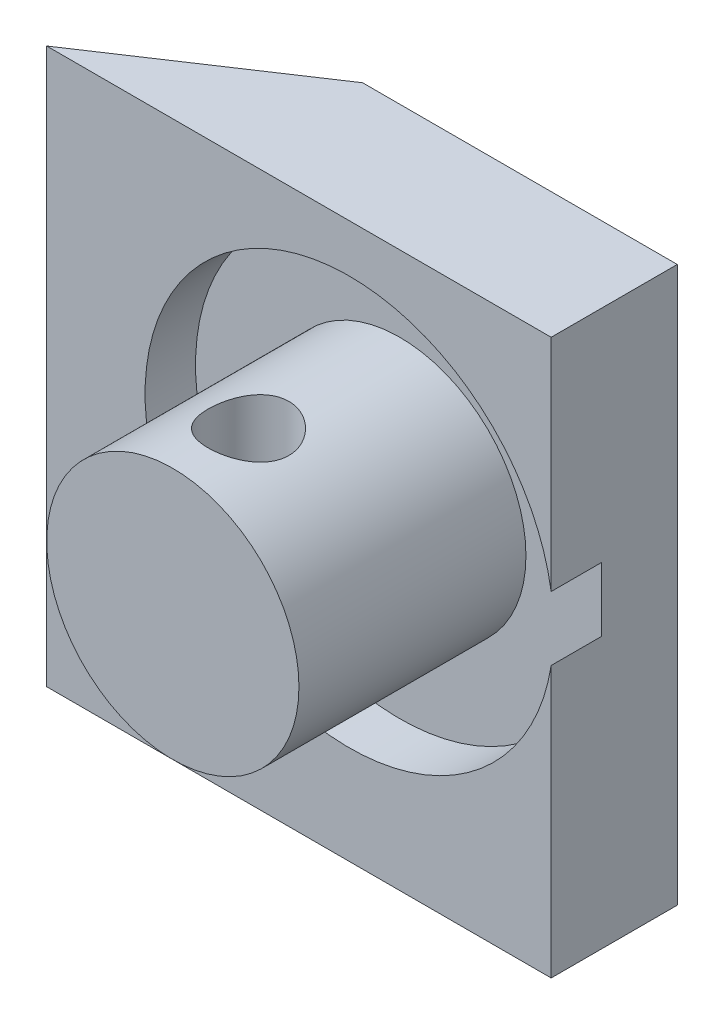
from build123d import *

# Parameters (mm, degrees)
EXTRUDE_1_DEPTH     = 22
SKETCH_2_R          = 5
EXTRUDE_2_DEPTH     = 7
CUT_EXTRUDE_START   = -2
SKETCH_3_R          = 8.1
SKETCH_3_R_2        = 5
CUT_EXTRUDE_1_DEPTH = 2
SKETCH_4_R          = 1.6
CUT_EXTRUDE_2_DEPTH = 31.545048699


with BuildPart() as part:
    # 草图1 → 凸台-拉伸1 (new body)
    with BuildSketch(Plane(origin=(0, 0, 0), x_dir=(1, 0, 0), z_dir=(0, 1, 0))):
        Polygon((0, 0), (-20, 0), (-12.477453102, 5), (0, 5), align=None)
    extrude(amount=EXTRUDE_1_DEPTH)

    # 草图2 → 凸台-拉伸2 (add)
    with BuildSketch(Plane.XY):
        with Locations((-8, 12)):
            Circle(SKETCH_2_R)
    extrude(amount=EXTRUDE_2_DEPTH)

    # 草图3 → 切除-拉伸1 (cut)
    with BuildSketch(Plane.XY.offset(CUT_EXTRUDE_START)):
        with Locations((-8, 12)):
            Circle(SKETCH_3_R)
        with Locations((-8, 12)):
            Circle(SKETCH_3_R_2, mode=Mode.SUBTRACT)
    extrude(amount=CUT_EXTRUDE_1_DEPTH, mode=Mode.SUBTRACT)

    # 草图4 → 切除-拉伸2 (cut, through all)
    with BuildSketch(Plane(origin=(0, 0, 0), x_dir=(1, 0, 0), z_dir=(0, 1, 0))):
        with Locations(Location((-8, -4, 0), (0, 0, 90))):
            Circle(SKETCH_4_R)
    extrude(amount=CUT_EXTRUDE_2_DEPTH, mode=Mode.SUBTRACT)


solid = part.part
